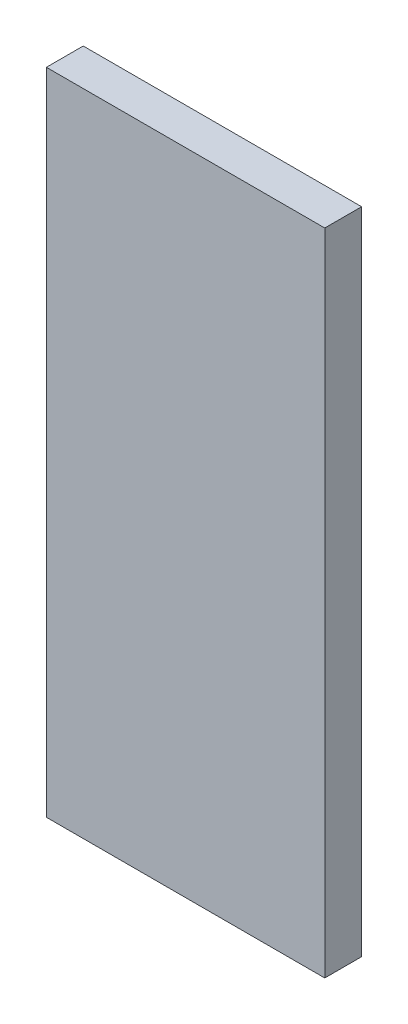
from build123d import *

# Parameters (mm, degrees)
SKETCH1_W           = 15.106784102
SKETCH1_H           = 35.249746584
BOSS_EXTRUDE1_DEPTH = 2
SKETCH2_R           = 1.880080874
SKETCH2_R_2         = 2.135178256
BOSS_EXTRUDE2_DEPTH = 3
FILLET1_R           = 1.5


with BuildPart() as part:
    # Sketch1 → Boss-Extrude1 (new body)
    with BuildSketch(Plane.XY):
        Rectangle(SKETCH1_W, SKETCH1_H)
    extrude(amount=BOSS_EXTRUDE1_DEPTH)

    # Sketch2 → Boss-Extrude2 (add)
    with BuildSketch(Plane(origin=(0, 0, 0), x_dir=(-1, 0, 0), z_dir=(0, 0, -1))):
        with Locations((0, 10.541590628)):
            Circle(SKETCH2_R)
        Circle(SKETCH2_R_2)
    extrude(amount=BOSS_EXTRUDE2_DEPTH)

    # Fillet1
    fillet1_edges = [part.edges().sort_by_distance(p)[0] for p in [
        (1.880080874, 10.541590628, -3),
        (2.135178256, 0, -3),
    ]]
    fillet(fillet1_edges, radius=FILLET1_R)


solid = part.part
